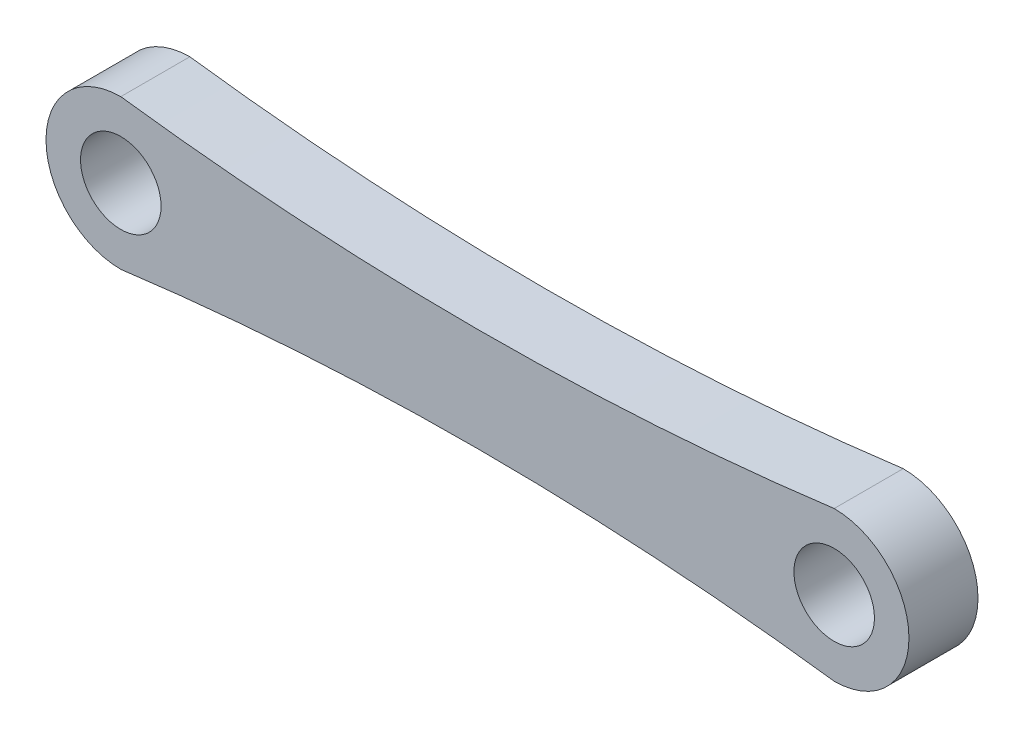
from build123d import *

# Parameters (mm, degrees)
SKETCH1_R           = 1.75
BOSS_EXTRUDE1_DEPTH = 3


with BuildPart() as part:
    # Sketch1 → Boss-Extrude1 (new body)
    with BuildSketch(Plane.XY):
        with BuildLine():
            ThreePointArc((14.688874122, 3.147153446), (0, 2.244747783), (-14.688874122, 3.147153446))
            ThreePointArc((-14.688874122, 3.147153446), (-15.094524654, 3.197885895), (-15.5, 3.25))
            ThreePointArc((-15.5, 3.25), (-18.75, 0), (-15.5, -3.25))
            ThreePointArc((-15.5, -3.25), (-15.094524654, -3.197885895), (-14.688874122, -3.147153446))
            ThreePointArc((-14.688874122, -3.147153446), (0, -2.244747783), (14.688874122, -3.147153446))
            ThreePointArc((14.688874122, -3.147153446), (15.094524654, -3.197885895), (15.5, -3.25))
            ThreePointArc((15.5, -3.25), (18.75, 0), (15.5, 3.25))
            ThreePointArc((15.5, 3.25), (15.094524654, 3.197885895), (14.688874122, 3.147153446))
        make_face()
        with Locations((-15.5, 0)):
            Circle(SKETCH1_R, mode=Mode.SUBTRACT)
        with Locations((15.5, 0)):
            Circle(SKETCH1_R, mode=Mode.SUBTRACT)
    extrude(amount=-BOSS_EXTRUDE1_DEPTH)


solid = part.part
